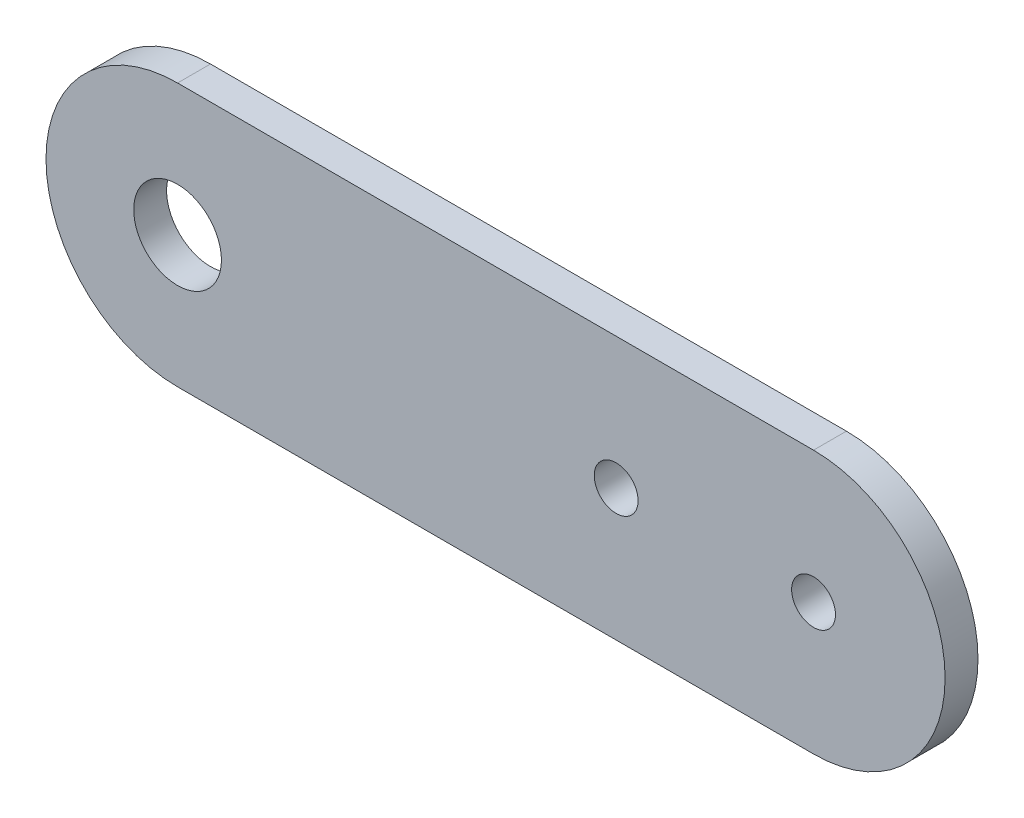
from build123d import *

# Parameters (mm, degrees)
SKETCH2_R           = 1
SKETCH2_R_2         = 2
BOSS_EXTRUDE1_DEPTH = 1.5


with BuildPart() as part:
    # Sketch2 → Boss-Extrude1 (new body)
    with BuildSketch(Plane.XY):
        with BuildLine():
            Line((0, 6), (-29, 6))
            ThreePointArc((-29, 6), (-35, 0), (-29, -6))
            Line((-29, -6), (0, -6))
            ThreePointArc((0, -6), (6, 0), (0, 6))
        make_face()
        Circle(SKETCH2_R, mode=Mode.SUBTRACT)
        with Locations((-9, 0)):
            Circle(SKETCH2_R, mode=Mode.SUBTRACT)
        with Locations((-29, 0)):
            Circle(SKETCH2_R_2, mode=Mode.SUBTRACT)
    extrude(amount=BOSS_EXTRUDE1_DEPTH)


solid = part.part
